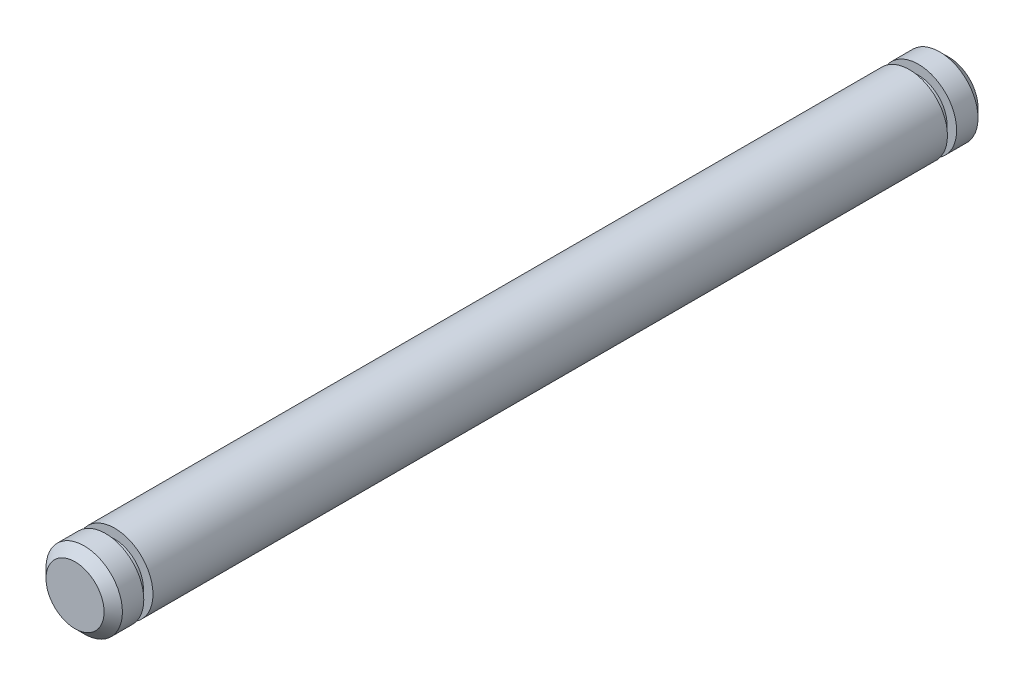
from build123d import *

# Parameters (mm, degrees)
SKETCH1_R                = 1.5875
BOSS_EXTRUDE1_DEPTH      = 16.50746
SKETCH2_R                = 1.19126
BOSS_EXTRUDE2_DEPTH      = 0.381
BOSS_EXTRUDE3_START      = 1.27
SKETCH3_R                = 1.5875
BOSS_EXTRUDE3_DEPTH      = 1.27
CHAMFER1_SIZE            = 0.381
CHAMFER1_OF_MIRROR1_SIZE = 0.381


with BuildPart() as part:
    # Sketch1 → Boss-Extrude1 (new, symmetric)
    with BuildSketch(Plane.XY):
        Circle(SKETCH1_R)
    extrude(amount=BOSS_EXTRUDE1_DEPTH, both=True)

    # Sketch2 → Boss-Extrude2 (add)
    with BuildSketch(Plane.XY.offset(16.50746)):
        with Locations(Location((0, 0, 0), (0, 0, 180))):
            Circle(SKETCH2_R)
    boss_extrude2 = extrude(amount=BOSS_EXTRUDE2_DEPTH)

    # Sketch3 → Boss-Extrude3 (add)
    with BuildSketch(Plane.XY.offset(16.88846).offset(BOSS_EXTRUDE3_START)):
        Circle(SKETCH3_R)
    boss_extrude3 = extrude(amount=-BOSS_EXTRUDE3_DEPTH)

    # Chamfer1
    chamfer1_edges = [part.edges().sort_by_distance(p)[0] for p in [
        (-1.5875, 0, 18.15846),
    ]]
    chamfer(chamfer1_edges, length=CHAMFER1_SIZE)

    # Mirror1: Boss-Extrude2, Boss-Extrude3 across plane
    add(boss_extrude2.mirror(Plane.XY))
    add(boss_extrude3.mirror(Plane.XY))

    # Chamfer1 of Mirror1
    chamfer1_of_mirror1_edges = [part.edges().sort_by_distance(p)[0] for p in [
        (-1.5875, 0, -18.15846),
    ]]
    chamfer(chamfer1_of_mirror1_edges, length=CHAMFER1_OF_MIRROR1_SIZE)


solid = part.part
